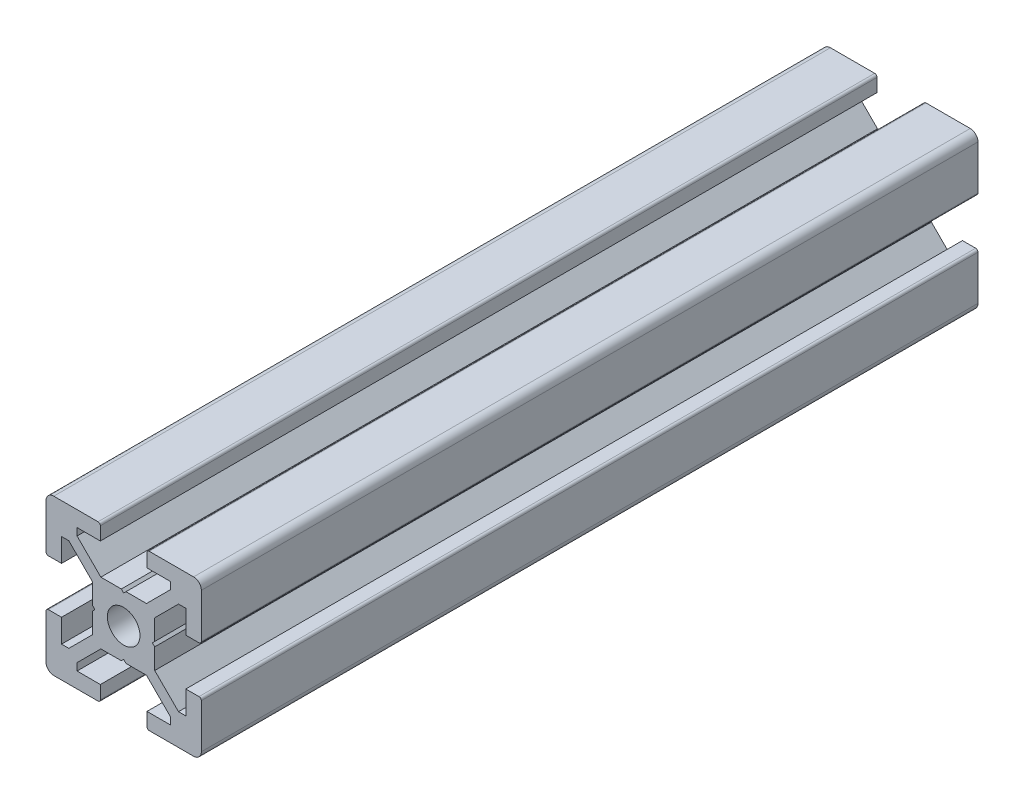
from build123d import *

# Parameters (mm, degrees)
SKETCH1_R           = 2.1
BOSS_EXTRUDE1_DEPTH = 50


with BuildPart() as part:
    # Sketch1 → Boss-Extrude1 (new, symmetric)
    with BuildSketch(Plane(origin=(0, 0, 0), x_dir=(-1, 0, 0), z_dir=(0, 0, -1))):
        with BuildLine():
            Line((10, 3.3), (10, 9))
            ThreePointArc((10, 9), (9.707106781, 9.707106781), (9, 10))
            Line((9, 10), (3.3, 10))
            ThreePointArc((3.3, 10), (3.087867966, 9.912132034), (3, 9.7))
            Line((3, 9.7), (3, 8))
            Line((3, 8), (6, 8))
            Line((6, 8), (6, 7.060660172))
            Line((6, 7.060660172), (2.939339828, 4))
            Line((2.939339828, 4), (0.3, 4))
            Line((0.3, 4), (0, 3.7))
            Line((0, 3.7), (-0.3, 4))
            Line((-0.3, 4), (-2.939339828, 4))
            Line((-2.939339828, 4), (-6, 7.060660172))
            Line((-6, 7.060660172), (-6, 8))
            Line((-6, 8), (-3, 8))
            Line((-3, 8), (-3, 9.7))
            ThreePointArc((-3, 9.7), (-3.087867966, 9.912132034), (-3.3, 10))
            Line((-3.3, 10), (-9, 10))
            ThreePointArc((-9, 10), (-9.707106781, 9.707106781), (-10, 9))
            Line((-10, 9), (-10, 3.3))
            ThreePointArc((-10, 3.3), (-9.912132034, 3.087867966), (-9.7, 3))
            Line((-9.7, 3), (-8, 3))
            Line((-8, 3), (-8, 6))
            Line((-8, 6), (-7.060660172, 6))
            Line((-7.060660172, 6), (-4, 2.939339828))
            Line((-4, 2.939339828), (-4, 0.3))
            Line((-4, 0.3), (-3.7, 0))
            Line((-3.7, 0), (-4, -0.3))
            Line((-4, -0.3), (-4, -2.939339828))
            Line((-4, -2.939339828), (-7.060660172, -6))
            Line((-7.060660172, -6), (-8, -6))
            Line((-8, -6), (-8, -3))
            Line((-8, -3), (-9.7, -3))
            ThreePointArc((-9.7, -3), (-9.912132034, -3.087867966), (-10, -3.3))
            Line((-10, -3.3), (-10, -9))
            ThreePointArc((-10, -9), (-9.707106781, -9.707106781), (-9, -10))
            Line((-9, -10), (-3.3, -10))
            ThreePointArc((-3.3, -10), (-3.087867966, -9.912132034), (-3, -9.7))
            Line((-3, -9.7), (-3, -8))
            Line((-3, -8), (-6, -8))
            Line((-6, -8), (-6, -7.060660172))
            Line((-6, -7.060660172), (-2.939339828, -4))
            Line((-2.939339828, -4), (-0.3, -4))
            Line((-0.3, -4), (0, -3.7))
            Line((0, -3.7), (0.3, -4))
            Line((0.3, -4), (2.939339828, -4))
            Line((2.939339828, -4), (6, -7.060660172))
            Line((6, -7.060660172), (6, -8))
            Line((6, -8), (3, -8))
            Line((3, -8), (3, -9.7))
            ThreePointArc((3, -9.7), (3.087867966, -9.912132034), (3.3, -10))
            Line((3.3, -10), (9, -10))
            ThreePointArc((9, -10), (9.707106781, -9.707106781), (10, -9))
            Line((10, -9), (10, -3.3))
            ThreePointArc((10, -3.3), (9.912132034, -3.087867966), (9.7, -3))
            Line((9.7, -3), (8, -3))
            Line((8, -3), (8, -6))
            Line((8, -6), (7.060660172, -6))
            Line((7.060660172, -6), (4, -2.939339828))
            Line((4, -2.939339828), (4, -0.3))
            Line((4, -0.3), (3.7, 0))
            Line((3.7, 0), (4, 0.3))
            Line((4, 0.3), (4, 2.939339828))
            Line((4, 2.939339828), (7.060660172, 6))
            Line((7.060660172, 6), (8, 6))
            Line((8, 6), (8, 3))
            Line((8, 3), (9.7, 3))
            ThreePointArc((9.7, 3), (9.912132034, 3.087867966), (10, 3.3))
        make_face()
        Circle(SKETCH1_R, mode=Mode.SUBTRACT)
    extrude(amount=BOSS_EXTRUDE1_DEPTH, both=True)


solid = part.part
